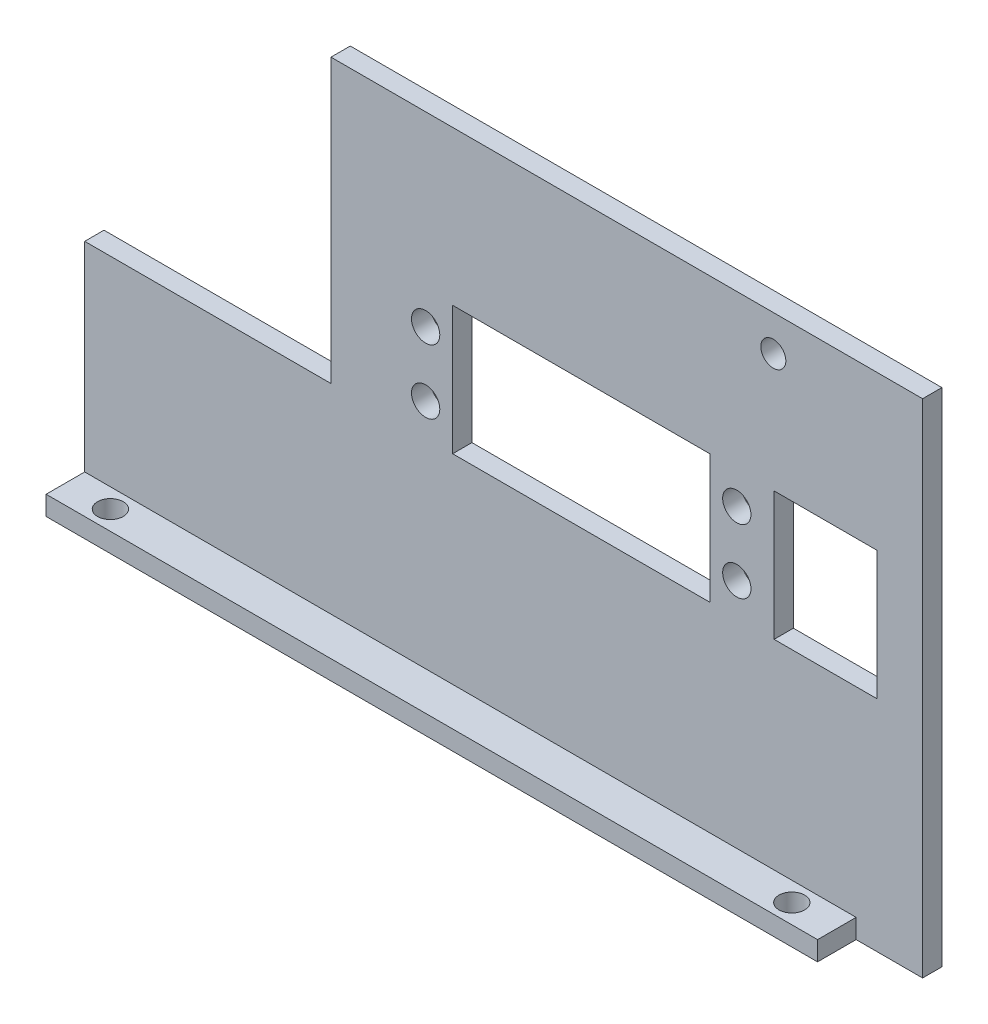
from build123d import *

# Parameters (mm, degrees)
SKETCH_1_R          = 2.2
SKETCH_1_R_2        = 1.95
SKETCH_1_W          = 40
SKETCH_1_H          = 20
SKETCH_1_W_2        = 16
EXTRUDE_1_DEPTH     = 1.5
SKETCH_2_W          = 120
SKETCH_2_H          = 3
EXTRUDE_2_DEPTH     = 6
SKETCH_3_R          = 2
CUT_EXTRUDE_1_DEPTH = 6


with BuildPart() as part:
    # 草图1 → 凸台-拉伸1 (new, symmetric)
    with BuildSketch(Plane.XY):
        Polygon((-0.084238348, 32.688738727), (91.943563532, 32.688738727), (91.943563532, -45.349139123), (-38.396296283, -45.349139123), (-38.396296283, -11.277844067), (-17.084238348, -11.277844067), (-0.084238348, -11.277844067), (-0.084238348, 8.722155933), align=None)
        with Locations((14.641461985, 3.722155933)):
            Circle(SKETCH_1_R, mode=Mode.SUBTRACT)
        with Locations((14.641461985, -6.277844067)):
            Circle(SKETCH_1_R, mode=Mode.SUBTRACT)
        with Locations((63.041461985, 3.722155933)):
            Circle(SKETCH_1_R, mode=Mode.SUBTRACT)
        with Locations((63.041461985, -6.277844067)):
            Circle(SKETCH_1_R, mode=Mode.SUBTRACT)
        with Locations((68.719491165, 27.139714958)):
            Circle(SKETCH_1_R_2, mode=Mode.SUBTRACT)
        with Locations((38.841461985, -1.277844067)):
            Rectangle(SKETCH_1_W, SKETCH_1_H, mode=Mode.SUBTRACT)
        with Locations((76.841461985, -1.277844067)):
            Rectangle(SKETCH_1_W_2, SKETCH_1_H, mode=Mode.SUBTRACT)
    extrude(amount=EXTRUDE_1_DEPTH, both=True)

    # 草图2 → 凸台-拉伸2 (add)
    with BuildSketch(Plane.XY.offset(1.5)):
        with Locations((21.603703717, -43.849139123)):
            Rectangle(SKETCH_2_W, SKETCH_2_H)
    extrude(amount=EXTRUDE_2_DEPTH)

    # 草图3 → 切除-拉伸1 (cut)
    with BuildSketch(Plane(origin=(0, -42.349139123, 0), x_dir=(1, 0, 0), z_dir=(0, 1, 0))):
        with Locations(Location((-31.396296283, -4.5, 0), (0, 0, 180))):
            Circle(SKETCH_3_R)
        with Locations(Location((74.603703717, -4.5, 0), (0, 0, 180))):
            Circle(SKETCH_3_R)
    extrude(amount=-CUT_EXTRUDE_1_DEPTH, mode=Mode.SUBTRACT)


solid = part.part
